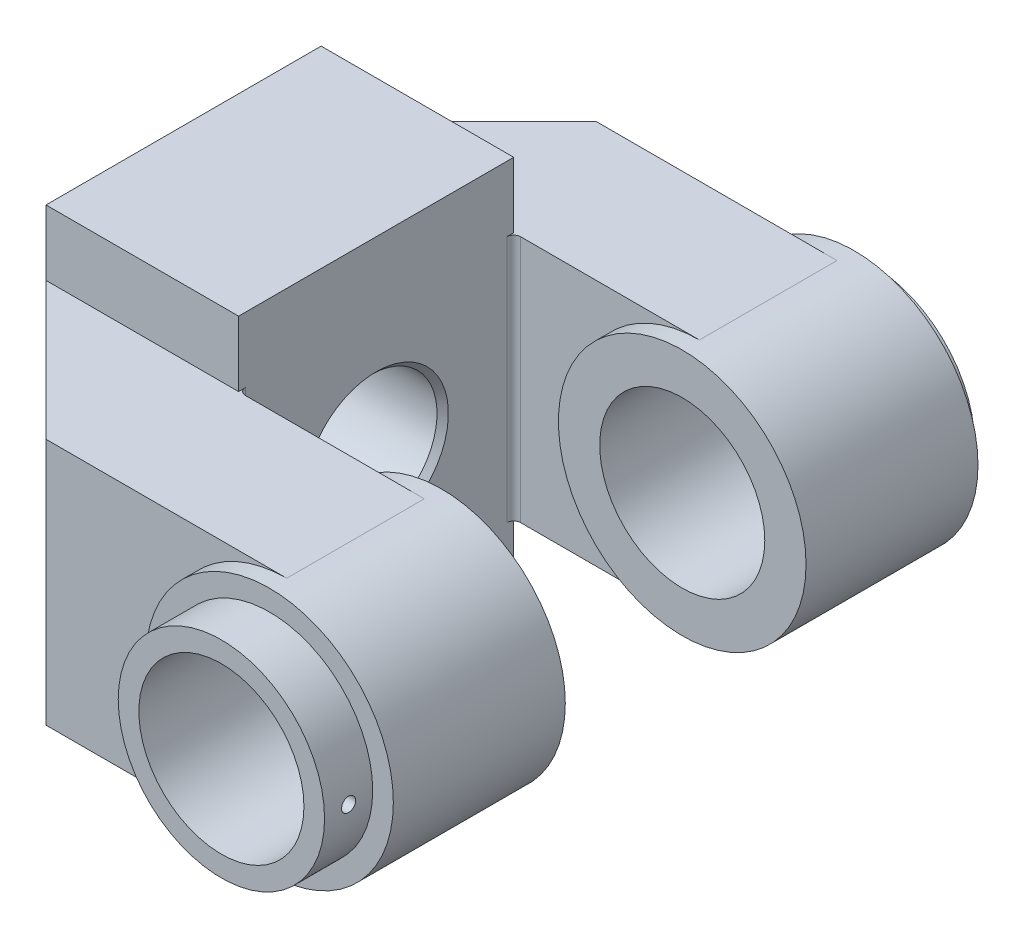
from build123d import *
from build123d.topology import SkipClean

# Parameters (mm, degrees)
SKETCH_1_W          = 56
SKETCH_1_H          = 110
EXTRUDE_1_DEPTH     = 40
SKETCH_3_W          = 56
SKETCH_3_H          = 72
EXTRUDE_2_DEPTH     = 40
SKETCH_4_R          = 36
SKETCH_4_R_2        = 24
EXTRUDE_3_DEPTH     = 25
SKETCH_5_R          = 30
SKETCH_5_R_2        = 24
EXTRUDE_4_DEPTH     = 5
CHAMFER_1_SIZE      = 40
FILLET_1_R          = 2
SKETCH_6_R          = 19.352
CUT_EXTRUDE_1_DEPTH = 181.113853
CHAMFER_2_SIZE      = 1.648
SKETCH_7_R          = 30
SKETCH_7_R_2        = 24
EXTRUDE_5_DEPTH     = 9
SKETCH_8_R          = 2.05
CUT_EXTRUDE_2_DEPTH = 158.879701


with BuildPart() as part:
    # Эскиз1 → Бобышка-Вытянуть1 (new body)
    with BuildSketch(Plane.XY):
        Rectangle(SKETCH_1_W, SKETCH_1_H)
    extrude(amount=EXTRUDE_1_DEPTH)

    # Эскиз3 → Бобышка-Вытянуть2 (add)
    with BuildSketch(Plane.XY.offset(40)):
        Rectangle(SKETCH_3_W, SKETCH_3_H)
        with BuildLine():
            Line((28, 36), (28, -36))
            Line((28, -36), (82, -36))
            ThreePointArc((82, -36), (46, 0), (82, 36))
            Line((82, 36), (28, 36))
        make_face()
        with BuildLine():
            ThreePointArc((82, 36), (46, 0), (82, -36))
            Line((82, -36), (82, -24))
            ThreePointArc((82, -24), (58, 0), (82, 24))
            Line((82, 24), (82, 36))
        make_face()
        with BuildLine():
            Line((82, -24), (82, -36))
            ThreePointArc((82, -36), (107.455844, -25.455844), (118, 0))
            ThreePointArc((118, 0), (107.455844, 25.455844), (82, 36))
            Line((82, 36), (82, 24))
            ThreePointArc((82, 24), (98.970563, 16.970563), (106, 0))
            ThreePointArc((106, 0), (98.970563, -16.970563), (82, -24))
        make_face()
    extrude(amount=EXTRUDE_2_DEPTH)

    # Эскиз4 → Бобышка-Вытянуть3 (add, symmetric)
    with BuildSketch(Plane.XY.offset(60)):
        with Locations((82, 0)):
            Circle(SKETCH_4_R)
        with Locations((82, 0)):
            Circle(SKETCH_4_R_2, mode=Mode.SUBTRACT)
    extrude(amount=EXTRUDE_3_DEPTH, both=True)

    # Эскиз5 → Бобышка-Вытянуть4 (add)
    with BuildSketch(Plane.XY.offset(85)):
        with Locations((82, 0)):
            Circle(SKETCH_5_R)
        with Locations((82, 0)):
            Circle(SKETCH_5_R_2, mode=Mode.SUBTRACT)
    extrude(amount=EXTRUDE_4_DEPTH)

    # Фаска1
    chamfer_1_edges = [part.edges().sort_by_distance(p)[0] for p in [
        (-28, 0, 80),
    ]]
    chamfer(chamfer_1_edges, length=CHAMFER_1_SIZE)

    # Скругление1
    fillet_1_edges = [part.edges().sort_by_distance(p)[0] for p in [
        (28, 0, 40),
    ]]
    fillet(fillet_1_edges, radius=FILLET_1_R)

    # Зеркальное отражение1: part across plane


with BuildPart() as part_1:
    add(part.part)
    add(part.part.mirror(Plane(origin=(0, 0, 0), x_dir=(1, 0, 0), z_dir=(0, 0, -1))))

    # Эскиз6 → Вырез-Вытянуть1 (cut, through all)
    with BuildSketch(Plane.ZY.offset(28)):
        Circle(SKETCH_6_R)
    extrude(amount=-CUT_EXTRUDE_1_DEPTH, mode=Mode.SUBTRACT)

    # Фаска2
    chamfer_2_edges = [part_1.edges().sort_by_distance(p)[0] for p in [
        (28, -13.68393, 13.68393),
        (-28, 13.68393, 13.68393),
    ]]
    chamfer(chamfer_2_edges, length=CHAMFER_2_SIZE)

    # Эскиз7 → Бобышка-Вытянуть5 (add)
    with SkipClean():  # the faces are left unmerged after this step: merging them gives an invalid solid
        with BuildSketch(Plane.XY.offset(90)):
            with Locations((82, 0)):
                Circle(SKETCH_7_R)
            with Locations((82, 0)):
                Circle(SKETCH_7_R_2, mode=Mode.SUBTRACT)
        extrude(amount=EXTRUDE_5_DEPTH)

    # Эскиз8 → Вырез-Вытянуть2 (cut, through all)
    with SkipClean():  # the faces are left unmerged after this step: merging them gives an invalid solid
        with BuildSketch(Plane(origin=(82, 0, 0), x_dir=(0, 0, -1), z_dir=(1, 0, 0))):
            with Locations(Location((-92, 0, 0), (0, 0, 180))):
                Circle(SKETCH_8_R)
        extrude(amount=CUT_EXTRUDE_2_DEPTH, mode=Mode.SUBTRACT)


solid = part_1.part
